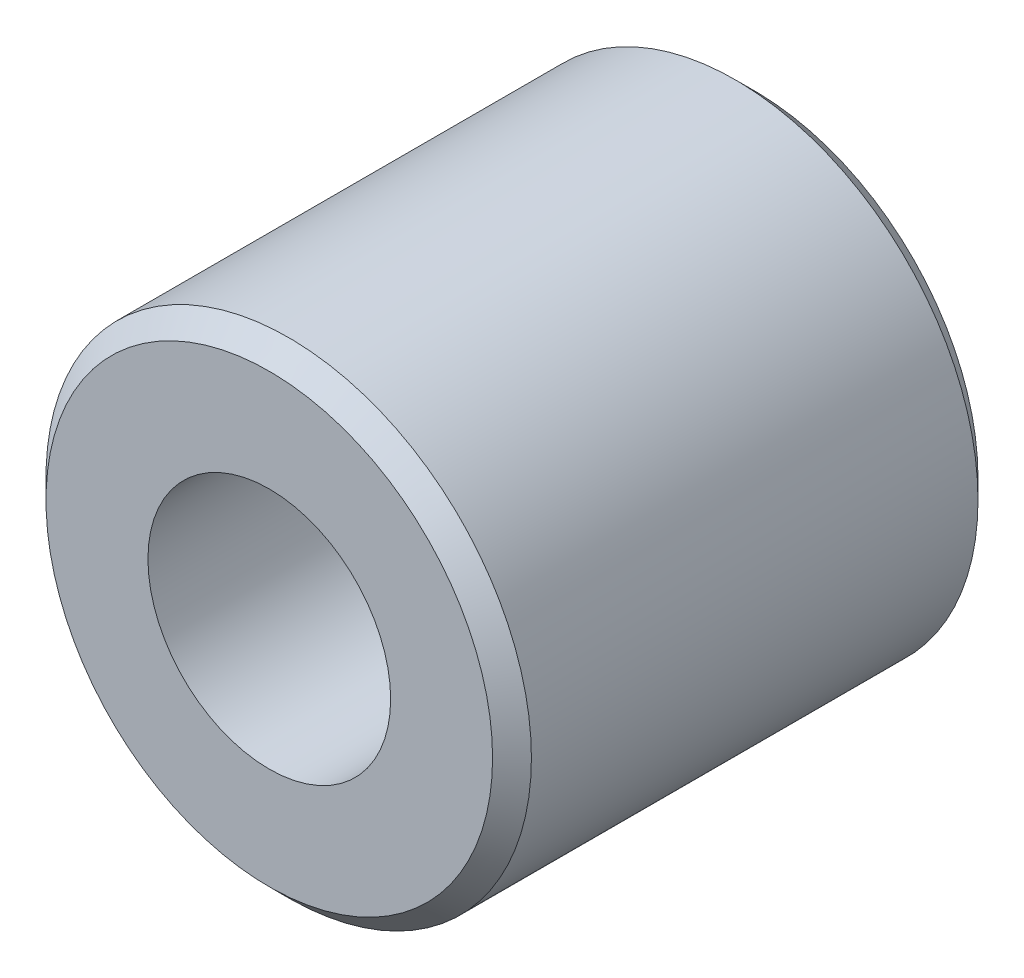
from build123d import *

# Parameters (mm, degrees)
SKETCH_1_R      = 2.5
SKETCH_1_R_2    = 1.25
EXTRUDE_1_DEPTH = 5
CHAMFER_1_SIZE  = 0.2


with BuildPart() as part:
    # 草图1 → 凸台-拉伸1 (new body)
    with BuildSketch(Plane.XY):
        Circle(SKETCH_1_R)
        Circle(SKETCH_1_R_2, mode=Mode.SUBTRACT)
    extrude(amount=EXTRUDE_1_DEPTH)

    # 倒角1
    chamfer_1_edges = [part.edges().sort_by_distance(p)[0] for p in [
        (-2.5, 0, 0),
        (-2.5, 0, 5),
    ]]
    chamfer(chamfer_1_edges, length=CHAMFER_1_SIZE)


solid = part.part
